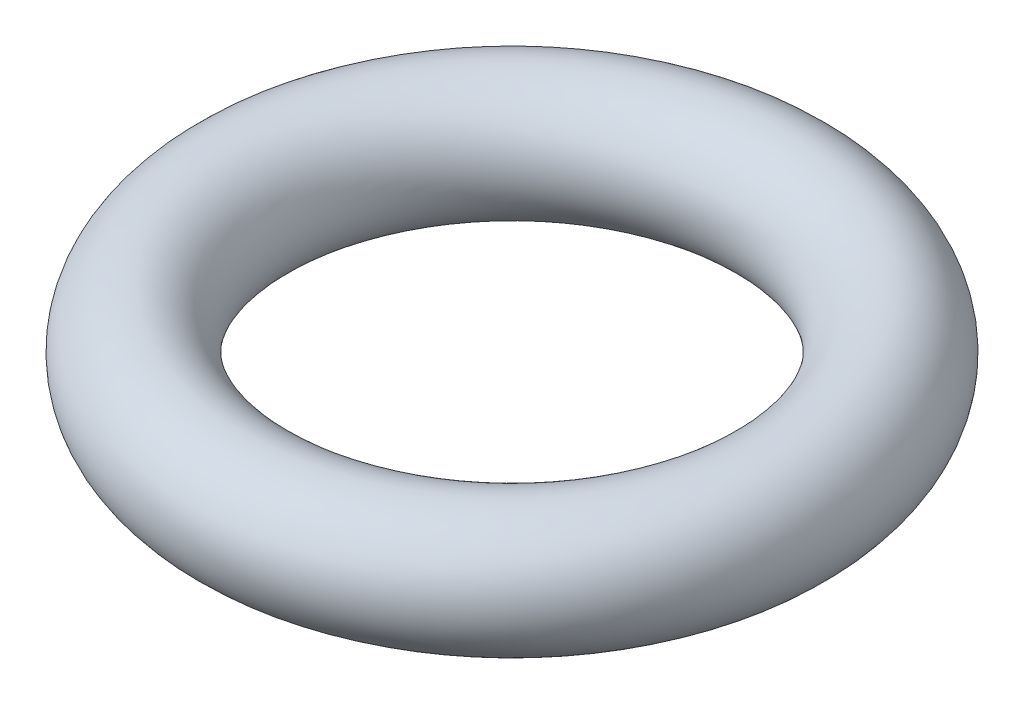
from build123d import *

# Parameters (mm, degrees)
SKETCH_1_R = 0.9


with BuildPart() as part:
    # 草图1 → Revolve 288 (revolve)
    with BuildSketch(Plane.XY, mode=Mode.PRIVATE) as revolve_288_sk:
        with Locations((3.9, 0)):
            Circle(SKETCH_1_R)
    revolve(revolve_288_sk.sketch.rotate(Axis((0, 0, 0), (0, 1, 0)), 90), axis=Axis((0, 0, 0), (0, 1, 0)))


solid = part.part
